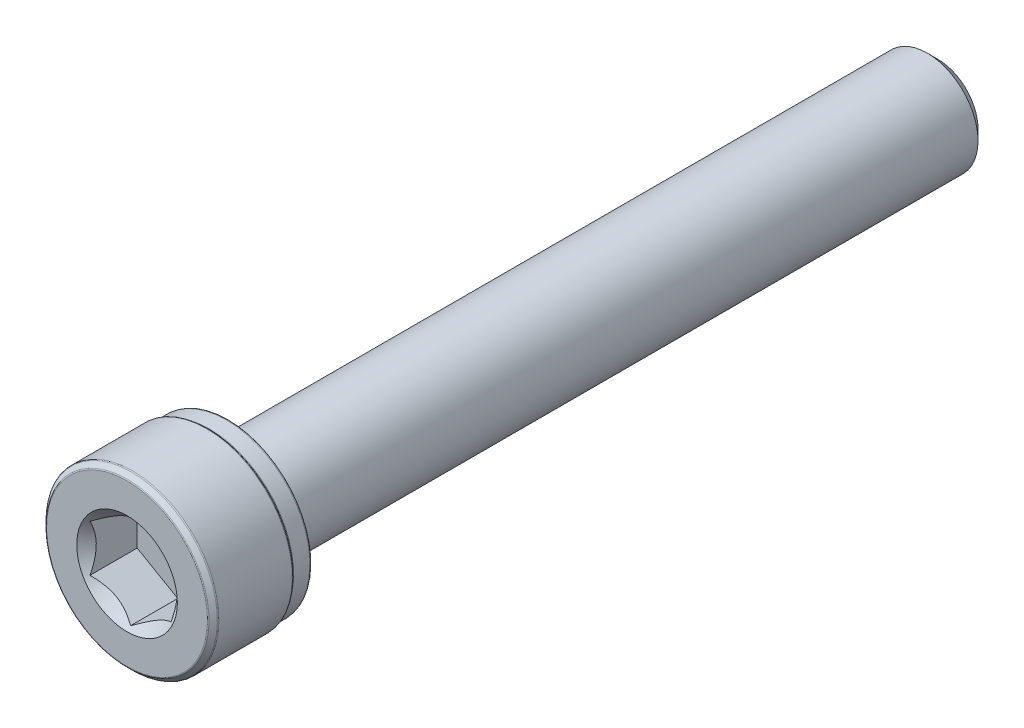
from build123d import *

# Parameters (mm, degrees)
CUT_EXTRUDE1_START = -2.5
CUT_EXTRUDE1_DEPTH = 2.5


with BuildPart() as part:
    # Sketch2 → Revolve1 (revolve)
    with BuildSketch(Plane(origin=(0, 0, 0), x_dir=(0, 0, -1), z_dir=(1, 0, 0))):
        with BuildLine():
            Line((-20, 0), (-20, 3.967639565))
            ThreePointArc((-20, 3.967639565), (-19.994053088, 3.997536709), (-19.977117717, 4.022882283))
            Line((-19.977117717, 4.022882283), (-19.772882283, 4.227117717))
            ThreePointArc((-19.772882283, 4.227117717), (-19.747536709, 4.244053088), (-19.717639565, 4.25))
            Line((-19.717639565, 4.25), (-16.094860435, 4.25))
            ThreePointArc((-16.094860435, 4.25), (-16.064963291, 4.244053088), (-16.039617717, 4.227117717))
            Line((-16.039617717, 4.227117717), (-15.960382283, 4.147882283))
            ThreePointArc((-15.960382283, 4.147882283), (-15.935036709, 4.130946912), (-15.905139565, 4.125))
            Line((-15.905139565, 4.125), (-15.10625, 4.125))
            ThreePointArc((-15.10625, 4.125), (-15.031119904, 4.093880096), (-15, 4.01875))
            Line((-15, 4.01875), (-15, 2.75))
            ThreePointArc((-15, 2.75), (-14.926776695, 2.573223305), (-14.75, 2.5))
            Line((-14.75, 2.5), (19.480384758, 2.5))
            Line((19.480384758, 2.5), (20, 1.980384758))
            Line((20, 1.980384758), (20, 0))
            Line((20, 0), (-20, 0))
        make_face()
    revolve(axis=Axis((0, 0, -20), (0, 0, 1)))

    # Sketch3 → Cut-Extrude1 (cut)
    with BuildSketch(Plane.XY.offset(20).offset(CUT_EXTRUDE1_START)):
        Polygon((2, -1.154700538), (2, 1.154700538), (0, 2.309401077), (-2, 1.154700538), (-2, -1.154700538), (0, -2.309401077), align=None)
    extrude(amount=CUT_EXTRUDE1_DEPTH, mode=Mode.SUBTRACT)

    # Cut-Extrude2 cone 1 section (through the dimple's axis) → Cut-Extrude2 (revolve, cut)
    with BuildSketch(Plane(origin=(0, 0, 20), x_dir=(0, -1, 0), z_dir=(1, 0, 0))):
        Polygon((0, 0), (2.482606158, 0), (0, 2.482606158), align=None)
    revolve(axis=Axis((0, 0, 20), (0, 0, -1)), mode=Mode.SUBTRACT)


solid = part.part
